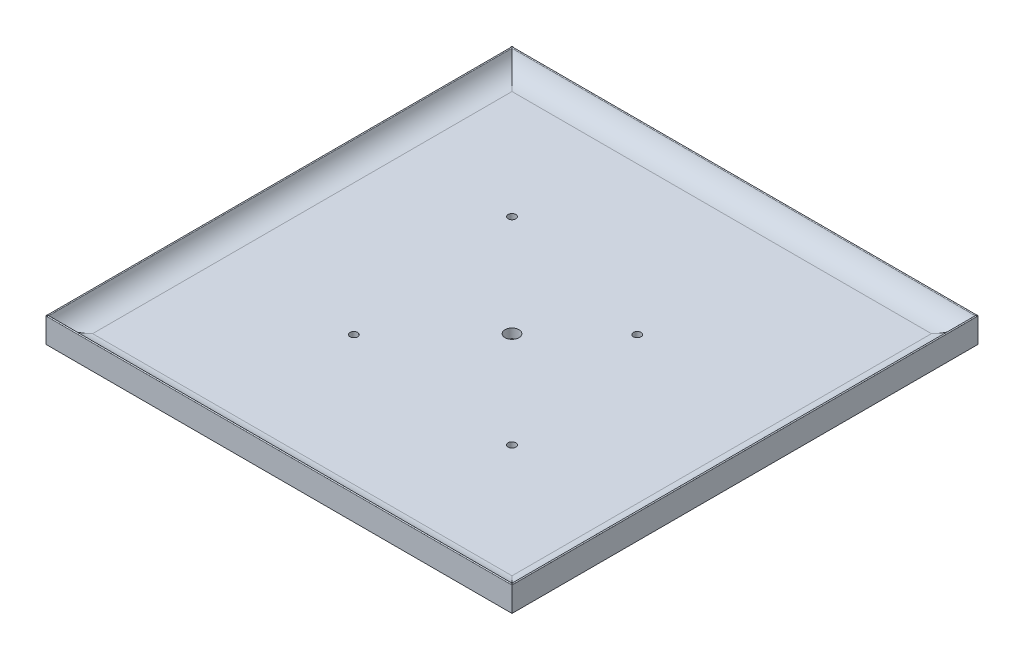
from build123d import *

# Parameters (mm, degrees)
SKETCH_1_W      = 200
SKETCH_1_H      = 200
SKETCH_1_R      = 3
SKETCH_1_R_2    = 1.65
EXTRUDE_1_DEPTH = 4
EXTRUDE_3_DEPTH = 100
EXTRUDE_4_DEPTH = 100


with BuildPart() as part:
    # 草图1 → 凸台-拉伸1 (new body)
    with BuildSketch(Plane(origin=(0, 0, 0), x_dir=(1, 0, 0), z_dir=(0, 1, 0))):
        Rectangle(SKETCH_1_W, SKETCH_1_H)
        with Locations(Location((0, 0, 0), (0, 0, 270))):
            Circle(SKETCH_1_R, mode=Mode.SUBTRACT)
        with Locations(Location((27.223611076, 26.516504294, 0), (0, 0, 270))):
            Circle(SKETCH_1_R_2, mode=Mode.SUBTRACT)
        with Locations(Location((-43.487067043, 43.487067043, 0), (0, 0, 270))):
            Circle(SKETCH_1_R_2, mode=Mode.SUBTRACT)
        with Locations(Location((-33.587572106, -34.294678888, 0), (0, 0, 270))):
            Circle(SKETCH_1_R_2, mode=Mode.SUBTRACT)
        with Locations(Location((41.365746699, -41.365746699, 0), (0, 0, 270))):
            Circle(SKETCH_1_R_2, mode=Mode.SUBTRACT)
    extrude(amount=EXTRUDE_1_DEPTH)

    # 草图3 → 凸台-拉伸3 (add, symmetric)
    with BuildSketch(Plane(origin=(0, 0, 0), x_dir=(0, 0, -1), z_dir=(1, 0, 0))):
        with BuildLine():
            Line((-100, 4), (-90, 4))
            ThreePointArc((-90, 4), (-95.760553163, 5.825892877), (-99.417475728, 10.636794548))
            ThreePointArc((-99.417475728, 10.636794548), (-99.751199211, 10.831497168), (-100, 10.535898385))
            Line((-100, 10.535898385), (-100, 4))
        make_face()
        with BuildLine():
            Line((100, 4), (100, 10.535898385))
            ThreePointArc((100, 10.535898385), (99.751199211, 10.831497168), (99.417475728, 10.636794548))
            ThreePointArc((99.417475728, 10.636794548), (95.760553163, 5.825892877), (90, 4))
            Line((90, 4), (100, 4))
        make_face()
    extrude(amount=EXTRUDE_3_DEPTH, both=True)

    # 草图5 → 凸台-拉伸4 (add, symmetric)
    with BuildSketch(Plane.XY):
        with BuildLine():
            Line((-100, 4), (-90, 4))
            ThreePointArc((-90, 4), (-95.760553163, 5.825892877), (-99.417475728, 10.636794548))
            ThreePointArc((-99.417475728, 10.636794548), (-99.751199211, 10.831497168), (-100, 10.535898385))
            Line((-100, 10.535898385), (-100, 4))
        make_face()
        with BuildLine():
            Line((100, 4), (100, 10.535898385))
            ThreePointArc((100, 10.535898385), (99.751199211, 10.831497168), (99.417475728, 10.636794548))
            ThreePointArc((99.417475728, 10.636794548), (95.760553163, 5.825892877), (90, 4))
            Line((90, 4), (100, 4))
        make_face()
    extrude(amount=EXTRUDE_4_DEPTH, both=True)


solid = part.part
